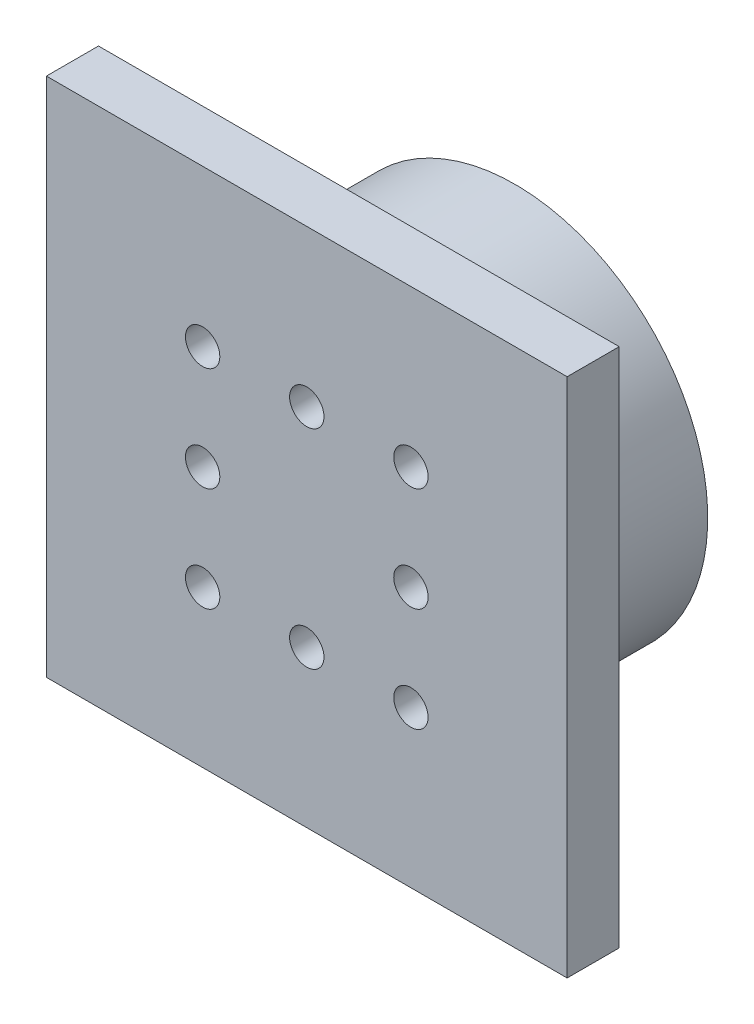
from build123d import *
from build123d.topology import SkipClean

# Parameters (mm, degrees)
SKETCH_1_W      = 50
SKETCH_1_H      = 50
SKETCH_1_R      = 1.65
EXTRUDE_1_DEPTH = 5
EXTRUDE_START   = 15
SKETCH_4_R      = 18.5
SKETCH_4_R_2    = 1.65
SKETCH_4_R_3    = 5
EXTRUDE_4_DEPTH = 15


with BuildPart() as part:
    # 草图1 → 凸台-拉伸1 (new body)
    with BuildSketch(Plane.XY):
        Rectangle(SKETCH_1_W, SKETCH_1_H)
        with Locations((-10, 10)):
            Circle(SKETCH_1_R, mode=Mode.SUBTRACT)
        with Locations((0, 10)):
            Circle(SKETCH_1_R, mode=Mode.SUBTRACT)
        with Locations((-10, 0)):
            Circle(SKETCH_1_R, mode=Mode.SUBTRACT)
        with Locations(Location((-10, -10, 0), (0, 0, 180))):
            Circle(SKETCH_1_R, mode=Mode.SUBTRACT)
        with Locations(Location((0, -10, 0), (0, 0, 180))):
            Circle(SKETCH_1_R, mode=Mode.SUBTRACT)
        with Locations((10, -10)):
            Circle(SKETCH_1_R, mode=Mode.SUBTRACT)
        with Locations(Location((10, 0, 0), (0, 0, 180))):
            Circle(SKETCH_1_R, mode=Mode.SUBTRACT)
        with Locations(Location((10, 10, 0), (0, 0, 180))):
            Circle(SKETCH_1_R, mode=Mode.SUBTRACT)
    extrude(amount=EXTRUDE_1_DEPTH)

    # 草图4 → 凸台-拉伸4 (add)
    with SkipClean():  # the faces are left unmerged after this step: merging them gives an invalid solid
        with BuildSketch(Plane(origin=(0, 0, 0), x_dir=(-1, 0, 0), z_dir=(0, 0, -1)).offset(EXTRUDE_START)):
            Circle(SKETCH_4_R)
            with Locations((10, -10)):
                Circle(SKETCH_4_R_2, mode=Mode.SUBTRACT)
            with Locations((0, -10)):
                Circle(SKETCH_4_R_2, mode=Mode.SUBTRACT)
            with Locations((-10, -10)):
                Circle(SKETCH_4_R_2, mode=Mode.SUBTRACT)
            with Locations((10, 0)):
                Circle(SKETCH_4_R_2, mode=Mode.SUBTRACT)
            with Locations((-10, 0)):
                Circle(SKETCH_4_R_2, mode=Mode.SUBTRACT)
            with Locations((10, 10)):
                Circle(SKETCH_4_R_2, mode=Mode.SUBTRACT)
            with Locations((0, 10)):
                Circle(SKETCH_4_R_2, mode=Mode.SUBTRACT)
            Circle(SKETCH_4_R_3, mode=Mode.SUBTRACT)
            with Locations((-10, 10)):
                Circle(SKETCH_4_R_2, mode=Mode.SUBTRACT)
        extrude(amount=-EXTRUDE_4_DEPTH)


solid = part.part
